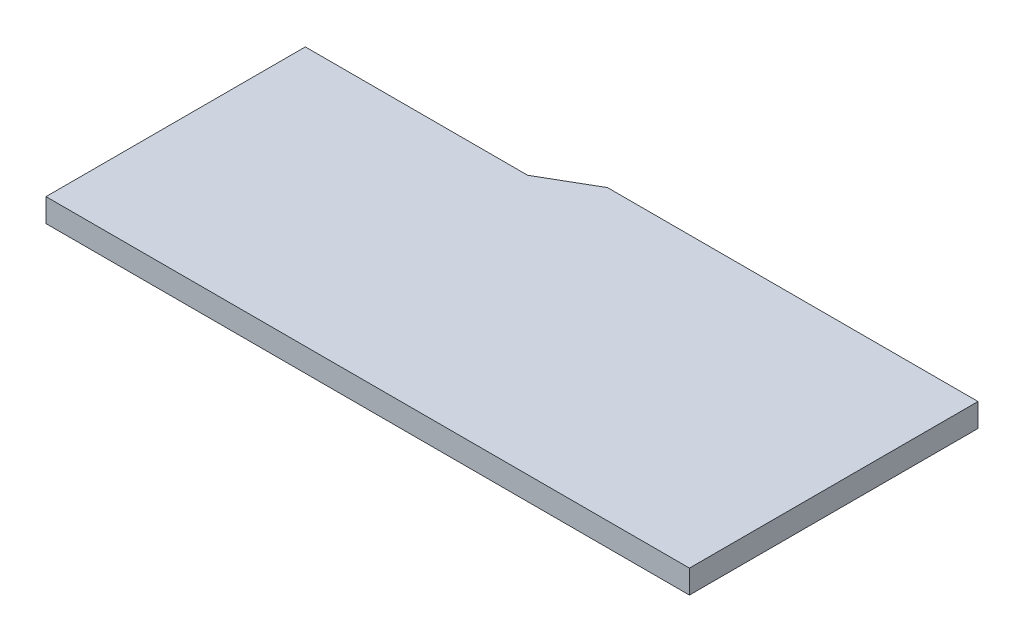
from build123d import *

# Parameters (mm, degrees)
SALIENTE_EXTRUIR1_DEPTH = 12


with BuildPart() as part:
    # Croquis1 → Saliente-Extruir1 (new body)
    with BuildSketch(Plane(origin=(0, 0, 0), x_dir=(1, 0, 0), z_dir=(0, 1, 0))):
        Polygon((-165, 133), (-165, 0), (165, 0), (165, 148), (-25, 148), (-50.980762114, 133), align=None)
    extrude(amount=SALIENTE_EXTRUIR1_DEPTH)


solid = part.part
